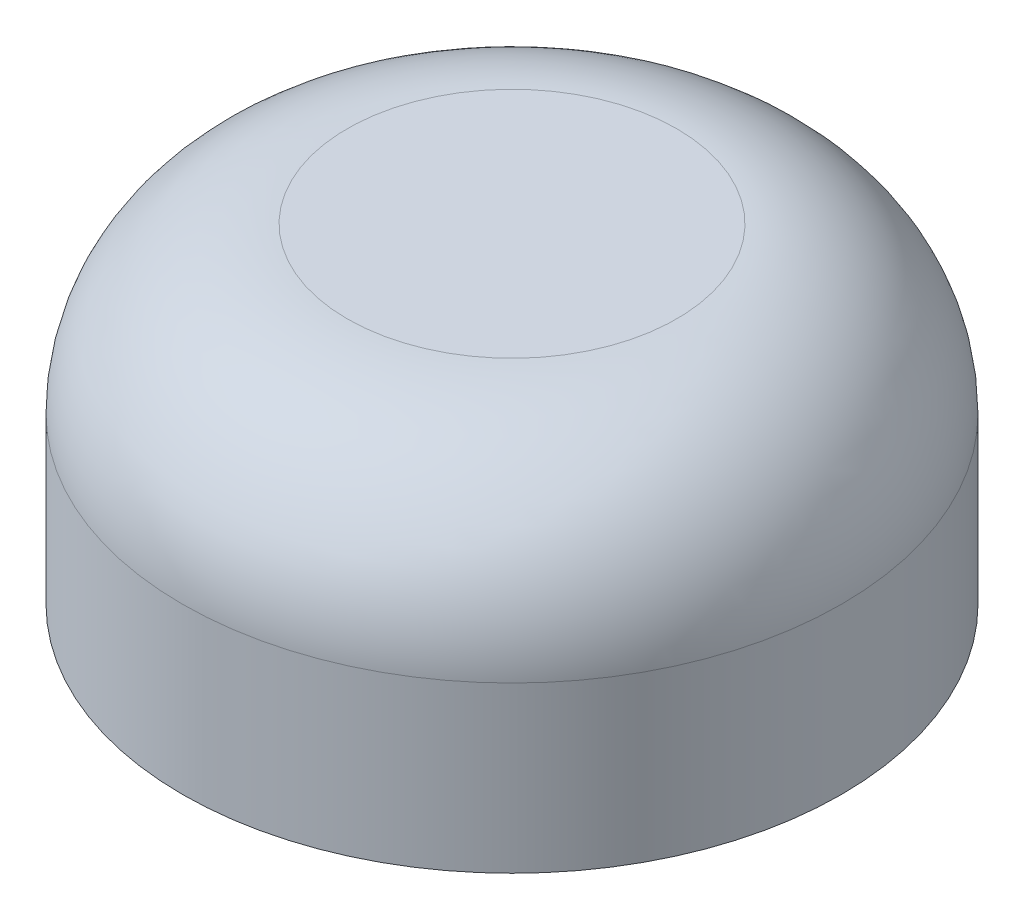
from build123d import *

# Parameters (mm, degrees)
SKETCH1_R           = 6.35
BOSS_EXTRUDE1_DEPTH = 6.35
SKETCH2_R           = 3.175
CUT_EXTRUDE1_DEPTH  = 3.556
FILLET1_R           = 3.175


with BuildPart() as part:
    # Sketch1 → Boss-Extrude1 (new body)
    with BuildSketch(Plane(origin=(0, 0, 0), x_dir=(1, 0, 0), z_dir=(0, 1, 0))):
        with Locations(Location((0, 0, 0), (0, 0, 270))):
            Circle(SKETCH1_R)
    extrude(amount=BOSS_EXTRUDE1_DEPTH)

    # Sketch2 → Cut-Extrude1 (cut)
    with BuildSketch(Plane.XZ):
        with Locations(Location((0, 0, 0), (0, 0, 270))):
            Circle(SKETCH2_R)
    extrude(amount=-CUT_EXTRUDE1_DEPTH, mode=Mode.SUBTRACT)

    # Fillet1
    fillet1_edges = [part.edges().sort_by_distance(p)[0] for p in [
        (0, 6.35, -6.35),
    ]]
    fillet(fillet1_edges, radius=FILLET1_R)


solid = part.part
